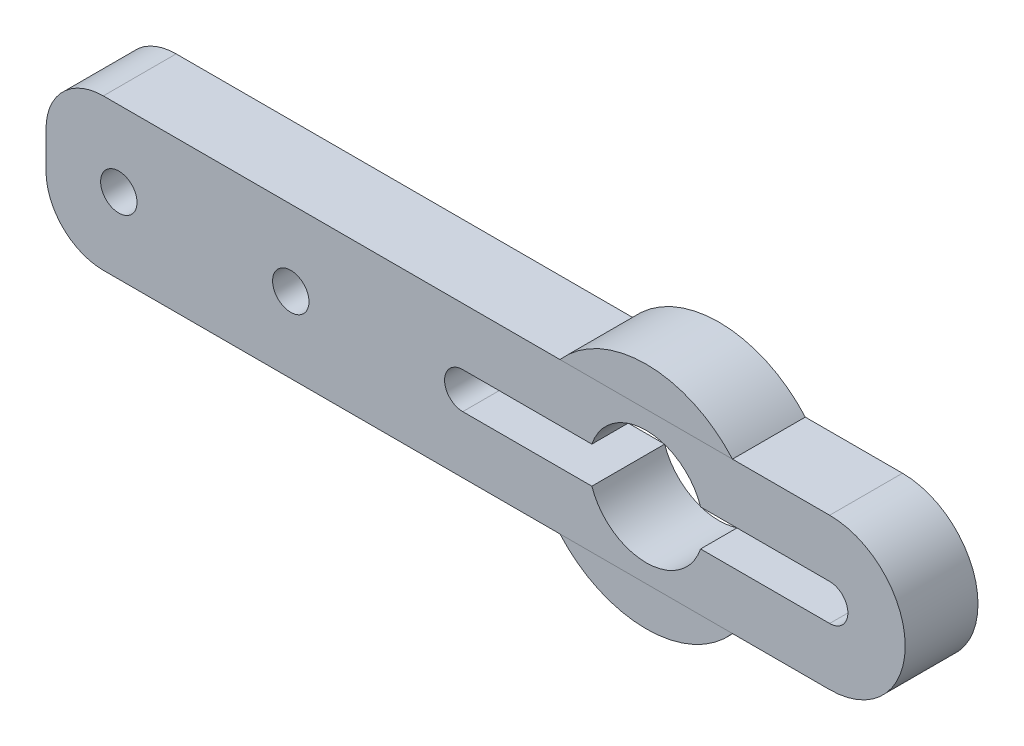
from build123d import *

# Parameters (mm, degrees)
BOSS_EXTRUDE1_DEPTH   = 6.35
SKETCH2_R             = 1.5875
BOSS_EXTRUDE2_DEPTH   = 6.35
FILLET1_R             = 5
SKETCH3_R             = 5
CUT_EXTRUDE1_DEPTH    = 40.657443343
BOSS_EXTRUDE3_DEPTH   = 6.35
BOSS_EXTRUDE3_2_DEPTH = 6.35


with BuildPart() as part:
    # Sketch1 → Boss-Extrude1 (new body)
    with BuildSketch(Plane.XY):
        with BuildLine():
            Line((0, 6.5875), (32, 6.5875))
            ThreePointArc((32, 6.5875), (38.5875, 0), (32, -6.5875))
            Line((32, -6.5875), (0, -6.5875))
            ThreePointArc((0, -6.5875), (-6.5875, 0), (0, 6.5875))
        make_face()
        with BuildLine():
            Line((0, 1.5875), (32, 1.5875))
            ThreePointArc((32, 1.5875), (33.5875, 0), (32, -1.5875))
            Line((32, -1.5875), (0, -1.5875))
            ThreePointArc((0, -1.5875), (-1.5875, 0), (0, 1.5875))
        make_face(mode=Mode.SUBTRACT)
    extrude(amount=BOSS_EXTRUDE1_DEPTH)

    # Sketch2 → Boss-Extrude2 (add)
    with BuildSketch(Plane.XY.offset(6.35)):
        Polygon((-1.5875, -6.5875), (-36.35, -6.5875), (-36.35, 6.5875), (-1.5875, 6.5875), (1.809680537, 6.5875), (1.321773506, 5.998684352), (-1.5875, 4.621900503), (-1.5875, -3.765711661), (1.817888777, -6.5875), align=None)
        with Locations((-15, 0)):
            Circle(SKETCH2_R, mode=Mode.SUBTRACT)
        with Locations((-30, 0)):
            Circle(SKETCH2_R, mode=Mode.SUBTRACT)
    extrude(amount=-BOSS_EXTRUDE2_DEPTH)

    # Fillet1
    fillet1_edges = [part.edges().sort_by_distance(p)[0] for p in [
        (-36.35, -6.5875, 3.175),
        (-36.35, 6.5875, 3.175),
    ]]
    fillet(fillet1_edges, radius=FILLET1_R)

    # Sketch3 → Cut-Extrude1 (cut, through all)
    with BuildSketch(Plane.XY.offset(6.35)):
        with Locations((16, 0)):
            Circle(SKETCH3_R)
    extrude(amount=-CUT_EXTRUDE1_DEPTH, mode=Mode.SUBTRACT)


with BuildPart() as body_2:
    # Sketch4 → Boss-Extrude3 (new body)
    with BuildSketch(Plane.XY.offset(6.35)):
        with BuildLine():
            ThreePointArc((8.476380941, -6.5875), (16, -10), (23.523619059, -6.5875))
            Line((23.523619059, -6.5875), (8.476380941, -6.5875))
        make_face()
    extrude(amount=-BOSS_EXTRUDE3_DEPTH)


with BuildPart() as body_3:
    # Sketch4 → Boss-Extrude3 2 (new body)
    with BuildSketch(Plane.XY.offset(6.35)):
        with BuildLine():
            ThreePointArc((23.523619059, 6.5875), (16, 10), (8.476380941, 6.5875))
            Line((8.476380941, 6.5875), (23.523619059, 6.5875))
        make_face()
    extrude(amount=-BOSS_EXTRUDE3_2_DEPTH)


solid = Compound([part.part, body_2.part, body_3.part])
